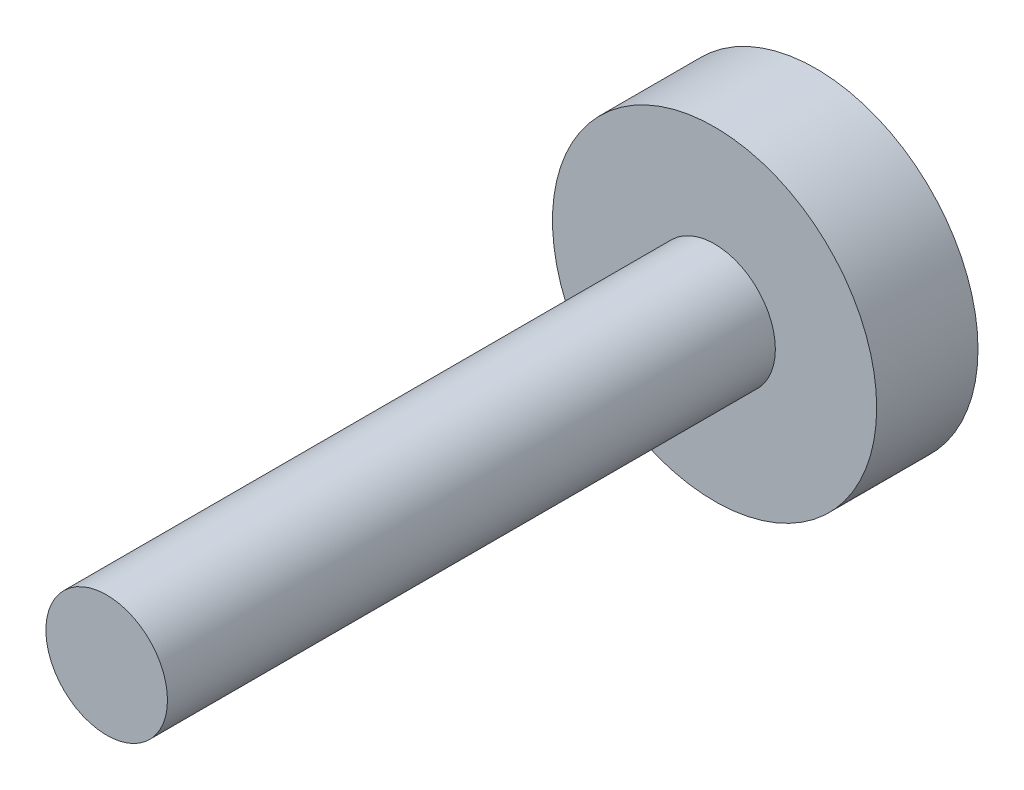
from build123d import *

# Parameters (mm, degrees)
SKETCH1_R           = 4
BOSS_EXTRUDE1_DEPTH = 2.5
SKETCH2_R           = 1.5
BOSS_EXTRUDE2_DEPTH = 15


with BuildPart() as part:
    # Sketch1 → Boss-Extrude1 (new body)
    with BuildSketch(Plane.XY):
        Circle(SKETCH1_R)
    extrude(amount=BOSS_EXTRUDE1_DEPTH)

    # Sketch2 → Boss-Extrude2 (add)
    with BuildSketch(Plane.XY.offset(2.5)):
        Circle(SKETCH2_R)
    extrude(amount=BOSS_EXTRUDE2_DEPTH)


solid = part.part
